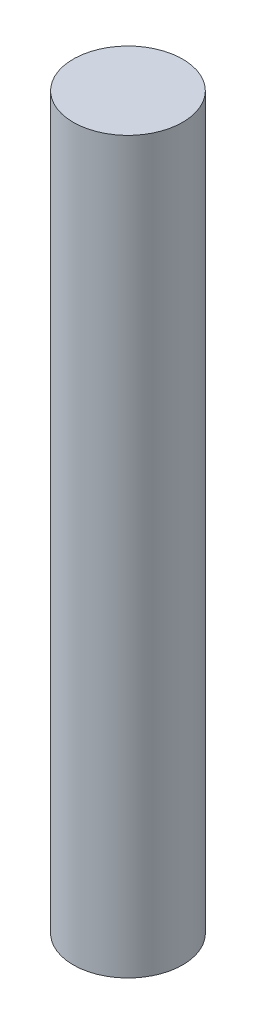
from build123d import *

# Parameters (mm, degrees)
SKETCH1_R           = 1.5
BOSS_EXTRUDE1_DEPTH = 20


with BuildPart() as part:
    # Sketch1 → Boss-Extrude1 (new body)
    with BuildSketch(Plane(origin=(0, 0, 0), x_dir=(1, 0, 0), z_dir=(0, 1, 0))):
        with Locations(Location((0, 1.439933594, 0), (0, 0, 270))):
            Circle(SKETCH1_R)
    extrude(amount=BOSS_EXTRUDE1_DEPTH)


solid = part.part
